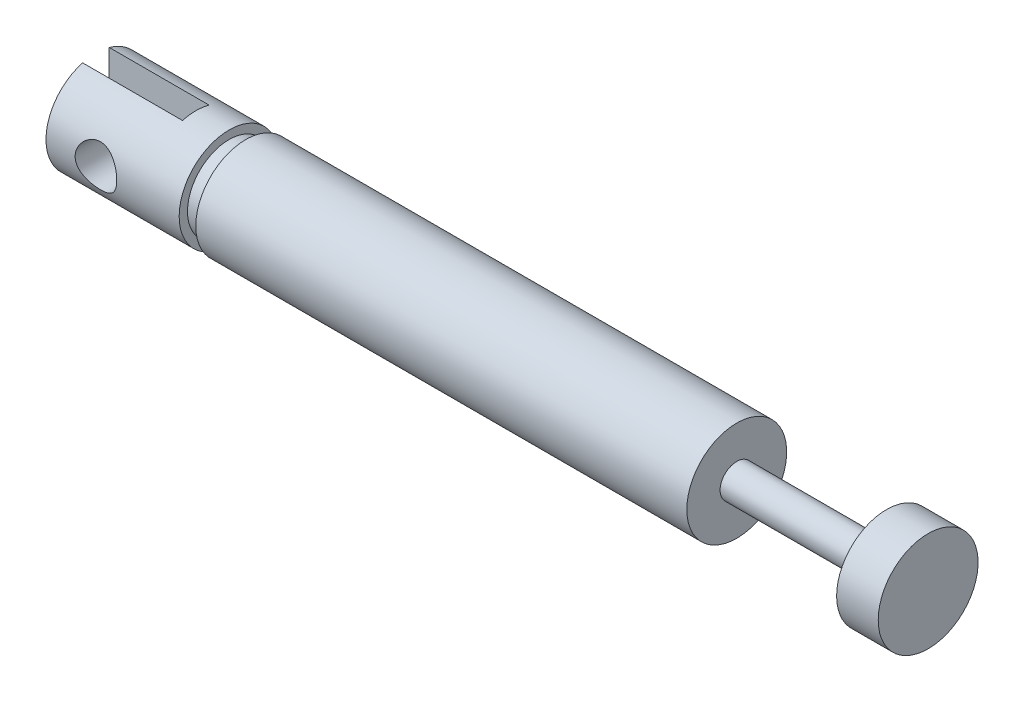
from build123d import *

# Parameters (mm, degrees)
ENL_V_MAT_EXTRU_5_DEPTH      = 51.179677161
ENL_V_MAT_EXTRU_5_DEPTH_BACK = 51.179677161
ESQUISSE6_R                  = 1.25
ENL_V_MAT_EXTRU_7_DEPTH      = 51.179677173
ENL_V_MAT_EXTRU_7_DEPTH_BACK = 51.179677173
ESQUISSE8_W                  = 6
ESQUISSE8_H                  = 0.8


with BuildPart() as part:
    # Esquisse1 → Révolution3 (revolve)
    with BuildSketch(Plane.XY, mode=Mode.PRIVATE) as r_volution3_sk:
        Polygon((38.5, 3), (38.5, 1), (47.5, 1), (47.5, 3), (50, 3), (50, 0), (0, 0), (0, 3), (8, 3), (8, 2.5), (9, 2.5), (9, 3), align=None)
    revolve(r_volution3_sk.sketch.rotate(Axis((0, 0, 0), (1, 0, 0)), 90), axis=Axis((0, 0, 0), (1, 0, 0)))

    # Esquisse6 → Enlèv. mat.-Extru.5 (cut, two sides: drawn at the far end of the back side and taken through both)
    with BuildSketch(Plane.XY.offset(-ENL_V_MAT_EXTRU_5_DEPTH_BACK)):
        with Locations((3, 0)):
            Circle(ESQUISSE6_R)
    extrude(amount=ENL_V_MAT_EXTRU_5_DEPTH + ENL_V_MAT_EXTRU_5_DEPTH_BACK, mode=Mode.SUBTRACT)

    # Esquisse8 → Enlèv. mat.-Extru.7 (cut, two sides: drawn at the far end of the back side and taken through both)
    with BuildSketch(Plane(origin=(0, 0, 0), x_dir=(1, 0, 0), z_dir=(0, 1, 0)).offset(-ENL_V_MAT_EXTRU_7_DEPTH_BACK)):
        with Locations((3, 0.4)):
            Rectangle(ESQUISSE8_W, ESQUISSE8_H)
        with Locations((3, -0.4)):
            Rectangle(ESQUISSE8_W, ESQUISSE8_H)
    extrude(amount=ENL_V_MAT_EXTRU_7_DEPTH + ENL_V_MAT_EXTRU_7_DEPTH_BACK, mode=Mode.SUBTRACT)


solid = part.part
